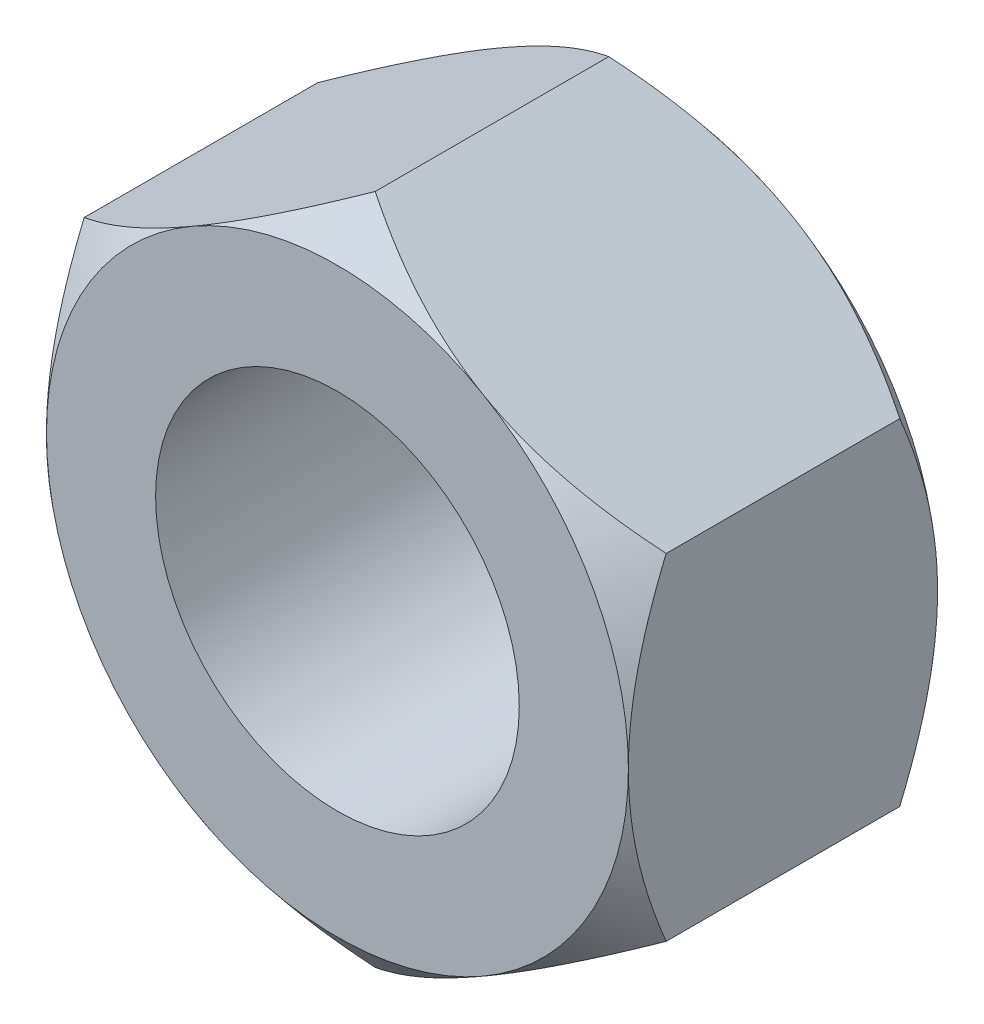
from build123d import *

# Parameters (mm, degrees)
EXTRUDE1_DEPTH     = 3.3734375
SKETCH2_R          = 3.96875
CUT_EXTRUDE1_DEPTH = 11.269659873


with BuildPart() as part:
    # Sketch1 → Extrude1 (new body)
    with BuildSketch(Plane.XY):
        Polygon((0, 7.332348419), (-6.35, 3.666174209), (-6.35, -3.666174209), (0, -7.332348419), (6.35, -3.666174209), (6.35, 3.666174209), align=None)
    extrude1 = extrude(amount=EXTRUDE1_DEPTH)

    # Sketch2 → Cut-Extrude1 (cut, through all)
    with BuildSketch(Plane.XY.offset(3.3734375)):
        Circle(SKETCH2_R)
    cut_extrude1 = extrude(amount=-CUT_EXTRUDE1_DEPTH, mode=Mode.SUBTRACT)

    # Sketch3 → Cut-Revolve1 (revolve, cut)
    with BuildSketch(Plane(origin=(0, 0, 0), x_dir=(1, 0, 0), z_dir=(0, 1, 0))):
        Polygon((6.35, -3.3734375), (9.525, -0.709296171), (9.525, -3.3734375), align=None)
    cut_revolve1 = revolve(axis=Axis((0, 0, 0), (0, 0, 1)), mode=Mode.SUBTRACT)

    # Mirror1: Extrude1, Cut-Extrude1, Cut-Revolve1 across plane
    add(extrude1.mirror(Plane(origin=(0, 7.332348419, 0), x_dir=(1, 0, 0), z_dir=(0, 0, 1))))
    add(cut_extrude1.mirror(Plane(origin=(0, 7.332348419, 0), x_dir=(1, 0, 0), z_dir=(0, 0, 1))), mode=Mode.SUBTRACT)
    add(cut_revolve1.mirror(Plane(origin=(0, 7.332348419, 0), x_dir=(1, 0, 0), z_dir=(0, 0, 1))), mode=Mode.SUBTRACT)


solid = part.part
